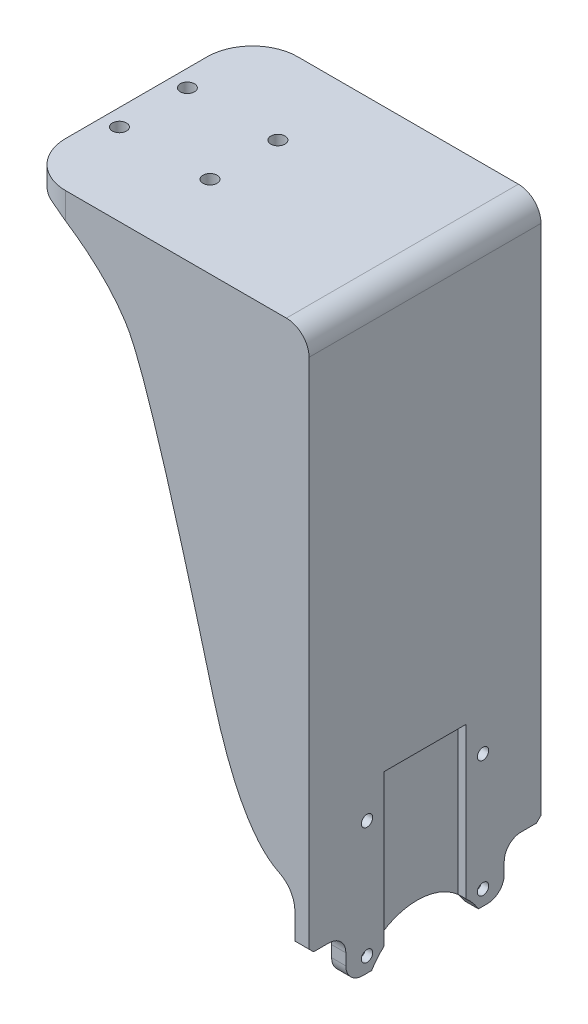
from build123d import *

# Parameters (mm, degrees)
SKETCH_1_W          = 51
SKETCH_1_H          = 41
SKETCH_1_R          = 1.25
EXTRUDE_1_DEPTH     = 3.4
SKETCH_2_R          = 1
EXTRUDE_2_DEPTH     = 2.5
SKETCH_3_W          = 14.5
SKETCH_3_H          = 35.737354226
CUT_EXTRUDE_1_DEPTH = 1.4
EXTRUDE_4_DEPTH     = 2
FILLET_1_R          = 8
FILLET_2_R          = 4
SKETCH_6_R          = 2
CUT_EXTRUDE_2_DEPTH = 1.2
CUT_EXTRUDE_3_DEPTH = 4
FILLET_3_R          = 3
SKETCH_9_R          = 2
CUT_EXTRUDE_4_DEPTH = 0.8
SKETCH_10_R         = 2.5
CUT_EXTRUDE_5_DEPTH = 1.4
CHAMFER_1_SIZE      = 0.8
FILLET_4_R          = 4
FILLET_5_R          = 5


with BuildPart() as part:
    # 草图1 → 凸台-拉伸1 (new body)
    with BuildSketch(Plane(origin=(0, 0, 0), x_dir=(1, 0, 0), z_dir=(0, 1, 0))):
        Rectangle(SKETCH_1_W, SKETCH_1_H)
        with Locations(Location((-22.5, 6, 0), (0, 0, 270))):
            Circle(SKETCH_1_R, mode=Mode.SUBTRACT)
        with Locations(Location((-22.5, -6, 0), (0, 0, 90))):
            Circle(SKETCH_1_R, mode=Mode.SUBTRACT)
        with Locations(Location((-6.5, 6, 0), (0, 0, 270))):
            Circle(SKETCH_1_R, mode=Mode.SUBTRACT)
        with Locations(Location((-6.5, -6, 0), (0, 0, 90))):
            Circle(SKETCH_1_R, mode=Mode.SUBTRACT)
    extrude(amount=EXTRUDE_1_DEPTH)

    # 草图2 → 凸台-拉伸2 (add)
    with BuildSketch(Plane(origin=(25.5, 0, 0), x_dir=(0, 0, -1), z_dir=(1, 0, 0))):
        with BuildLine():
            Line((-20.5, 0), (20.5, 0))
            Line((20.5, 0), (20.5, -100))
            Line((20.5, -100), (9.43808773, -100))
            ThreePointArc((9.43808773, -100), (0, -94.65), (-9.43808773, -100))
            Line((-9.43808773, -100), (-20.5, -100))
            Line((-20.5, -100), (-20.5, 0))
        make_face()
        with Locations((-10.25, -97.35)):
            Circle(SKETCH_2_R, mode=Mode.SUBTRACT)
        with Locations(Location((10.25, -97.35, 0), (0, 0, 180))):
            Circle(SKETCH_2_R, mode=Mode.SUBTRACT)
        with Locations((10.25, -76.65)):
            Circle(SKETCH_2_R, mode=Mode.SUBTRACT)
        with Locations(Location((-10.25, -76.65, 0), (0, 0, 180))):
            Circle(SKETCH_2_R, mode=Mode.SUBTRACT)
    extrude(amount=-EXTRUDE_2_DEPTH)

    # 草图3 → 切除-拉伸1 (cut)
    with BuildSketch(Plane(origin=(25.5, 0, 0), x_dir=(0, 0, -1), z_dir=(1, 0, 0))):
        with Locations((0, -88.518677113)):
            Rectangle(SKETCH_3_W, SKETCH_3_H)
    extrude(amount=-CUT_EXTRUDE_1_DEPTH, mode=Mode.SUBTRACT)

    # 草图5 → 凸台-拉伸4 (add)
    with BuildSketch(Plane(origin=(0, 0, -20.5), x_dir=(-1, 0, 0), z_dir=(0, 0, -1))):
        with BuildLine():
            Line((-25.5, 3.4), (19.5, 3.4))
            Line((19.5, 3.4), (19.5, 0))
            add(Edge.make_bspline(
                [(19.5, 0), (10.67122189, -5.3692624), (2.779429236, -18.193392293), (-14.23746955, -82.475470635), (-23, -82.805044976)],
                knots=[0, 0, 0, 0.396049025, 0.788579615, 1, 1, 1], degree=2))
            Line((-23, -82.805044976), (-25.5, -82.805044976))
            Line((-25.5, -82.805044976), (-25.5, 3.4))
        make_face()
    extrude_4 = extrude(amount=-EXTRUDE_4_DEPTH)

    # 镜向3: 凸台-拉伸4 across plane
    add(extrude_4.mirror(Plane.XY))

    # 圆角1
    fillet_1_edges = [part.edges().sort_by_distance(p)[0] for p in [
        (-25.5, 1.7, -20.5),
        (-25.5, 1.7, 20.5),
    ]]
    fillet(fillet_1_edges, radius=FILLET_1_R)

    # 圆角2
    fillet_2_edges = [part.edges().sort_by_distance(p)[0] for p in [
        (25.5, 3.4, 0),
        (23, 0, 0),
    ]]
    fillet(fillet_2_edges, radius=FILLET_2_R)

    # 草图6 → 切除-拉伸2 (cut)
    with BuildSketch(Plane.ZY.offset(-23)):
        with Locations((10.25, -97.35)):
            Circle(SKETCH_6_R)
        with Locations((-10.25, -97.35)):
            Circle(SKETCH_6_R)
    extrude(amount=-CUT_EXTRUDE_2_DEPTH, mode=Mode.SUBTRACT)

    # 草图8 → 切除-拉伸3 (cut)
    with BuildSketch(Plane(origin=(25.5, 0, 0), x_dir=(0, 0, -1), z_dir=(1, 0, 0))):
        Polygon((14, -102.818047241), (14, -92), (23.468492482, -92), (23.468492482, -110.008191191), (-23.468492482, -110.008191191), (-23.468492482, -92), (-14, -92), (-14, -102.818047241), align=None)
    extrude(amount=-CUT_EXTRUDE_3_DEPTH, mode=Mode.SUBTRACT)

    # 圆角3
    fillet_3_edges = [part.edges().sort_by_distance(p)[0] for p in [
        (24.25, -100, 14),
        (24.25, -100, -14),
        (24.25, -92, -14),
        (24.25, -92, 14),
    ]]
    fillet(fillet_3_edges, radius=FILLET_3_R)

    # 草图9 → 切除-拉伸4 (cut)
    with BuildSketch(Plane.ZY.offset(-23)):
        with Locations((10.25, -76.65)):
            Circle(SKETCH_9_R)
        with Locations(Location((-10.25, -76.65, 0), (0, 0, 180))):
            Circle(SKETCH_9_R)
    extrude(amount=-CUT_EXTRUDE_4_DEPTH, mode=Mode.SUBTRACT)

    # 草图10 → 切除-拉伸5 (cut)
    with BuildSketch(Plane(origin=(0, 0, 0), x_dir=(-1, 0, 0), z_dir=(0, -1, 0))):
        with Locations(Location((6.5, -6, 0), (0, 0, 90))):
            Circle(SKETCH_10_R)
        with Locations(Location((22.5, -6, 0), (0, 0, 270))):
            Circle(SKETCH_10_R)
        with Locations(Location((6.5, 6, 0), (0, 0, 270))):
            Circle(SKETCH_10_R)
        with Locations(Location((22.5, 6, 0), (0, 0, 90))):
            Circle(SKETCH_10_R)
    extrude(amount=-CUT_EXTRUDE_5_DEPTH, mode=Mode.SUBTRACT)

    # 倒角1
    chamfer_1_edges = [part.edges().sort_by_distance(p)[0] for p in [
        (24.25, -92, 20.5),
        (24.25, -92, -20.5),
    ]]
    chamfer(chamfer_1_edges, length=CHAMFER_1_SIZE)

    # 圆角4
    fillet_4_edges = [part.edges().sort_by_distance(p)[0] for p in [
        (-0.25, 0, -18.5),
        (21.828427125, -1.171572875, -18.5),
        (-0.25, 0, 18.5),
        (21.828427125, -1.171572875, 18.5),
        (23, -43.402522488, -18.5),
        (23, -43.402522488, 18.5),
    ]]
    fillet(fillet_4_edges, radius=FILLET_4_R)

    # 圆角5
    fillet_5_edges = [part.edges().sort_by_distance(p)[0] for p in [
        (23, -82.805044976, 16.5),
        (23, -82.805044976, -16.5),
        (-19.5, 0, 16.5),
        (-19.5, 0, -16.5),
    ]]
    fillet(fillet_5_edges, radius=FILLET_5_R)


solid = part.part
